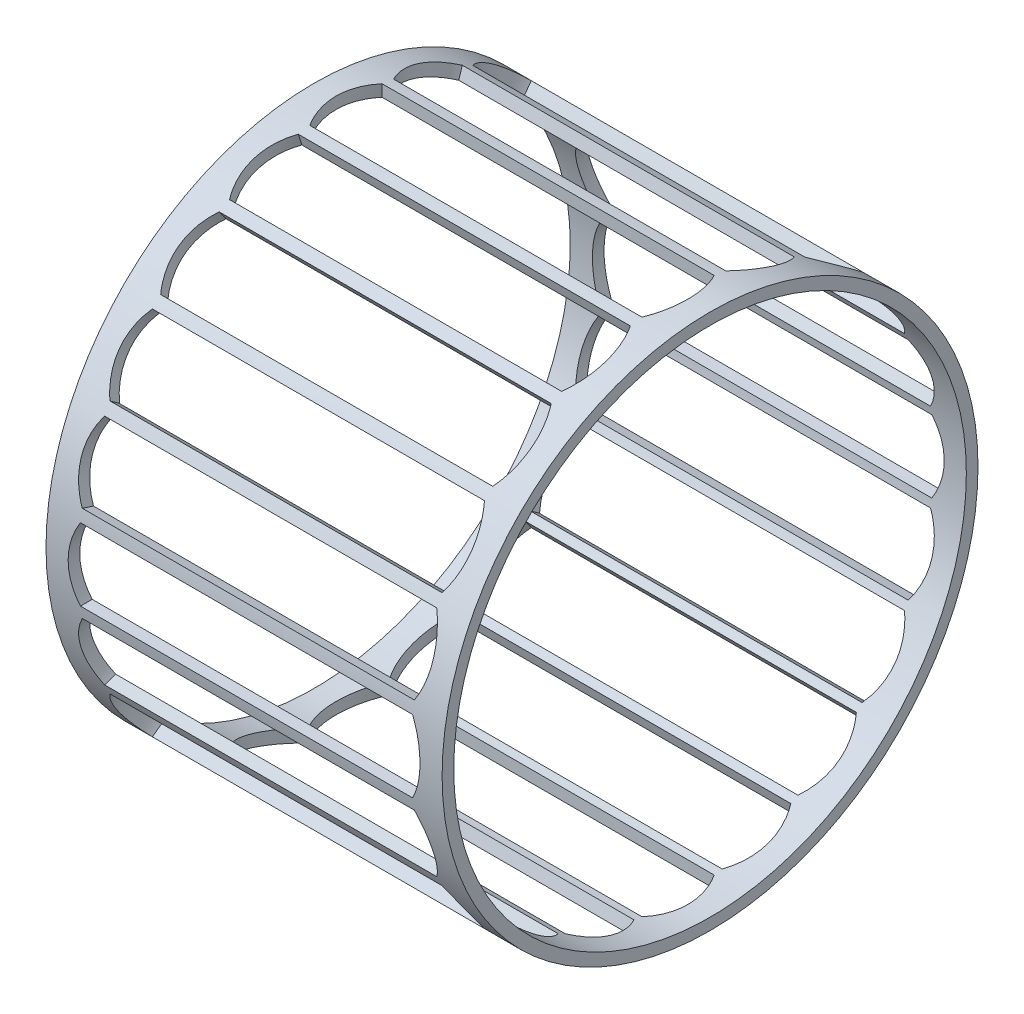
from build123d import *

# Parameters (mm, degrees)
ESQUISSE1_W                  = 17
ESQUISSE1_H                  = 0.5
ENL_V_MAT_EXTRU_1_REACH      = 29.083
R_P_TITION_CIRCULAIRE1_COUNT = 20


with BuildPart() as part:
    # Esquisse1 → Base-Révolution (revolve)
    with BuildSketch(Plane.XY):
        with Locations((7.5, 11.25)):
            Rectangle(ESQUISSE1_W, ESQUISSE1_H)
    revolve(axis=Axis((0, 0, 0), (1, 0, 0)))

    # Esquisse2 → Enlèv. mat.-Extru.1 (cut, up to next)
    with BuildSketch(Plane(origin=(7.5, 11.5, 0), x_dir=(0, 0, -1), z_dir=(0, 1, 0)), mode=Mode.PRIVATE) as enl_v_mat_extru_1_sk1:
        with BuildLine():
            Line((1.55, 7.126785107), (1.55, -7.126785107))
            ThreePointArc((1.55, -7.126785107), (0, -7.55), (-1.55, -7.126785107))
            Line((-1.55, -7.126785107), (-1.55, 7.126785107))
            ThreePointArc((-1.55, 7.126785107), (0, 7.55), (1.55, 7.126785107))
        make_face()
    enl_v_mat_extru_1_tool1 = extrude(enl_v_mat_extru_1_sk1.sketch, amount=-ENL_V_MAT_EXTRU_1_REACH, mode=Mode.PRIVATE) & part.part
    enl_v_mat_extru_1 = enl_v_mat_extru_1_tool1.solids().sort_by_distance((7.5, 11.5, 0))[0]
    add(enl_v_mat_extru_1, mode=Mode.SUBTRACT)

    # Répétition circulaire1: Enlèv. mat.-Extru.1 ×20 about axis
    r_p_tition_circulaire1_axis = Axis((0, 0, 0), (1, 0, 0))
    for i in range(1, R_P_TITION_CIRCULAIRE1_COUNT):
        add(enl_v_mat_extru_1.rotate(r_p_tition_circulaire1_axis, i * 360 / R_P_TITION_CIRCULAIRE1_COUNT), mode=Mode.SUBTRACT)


solid = part.part
